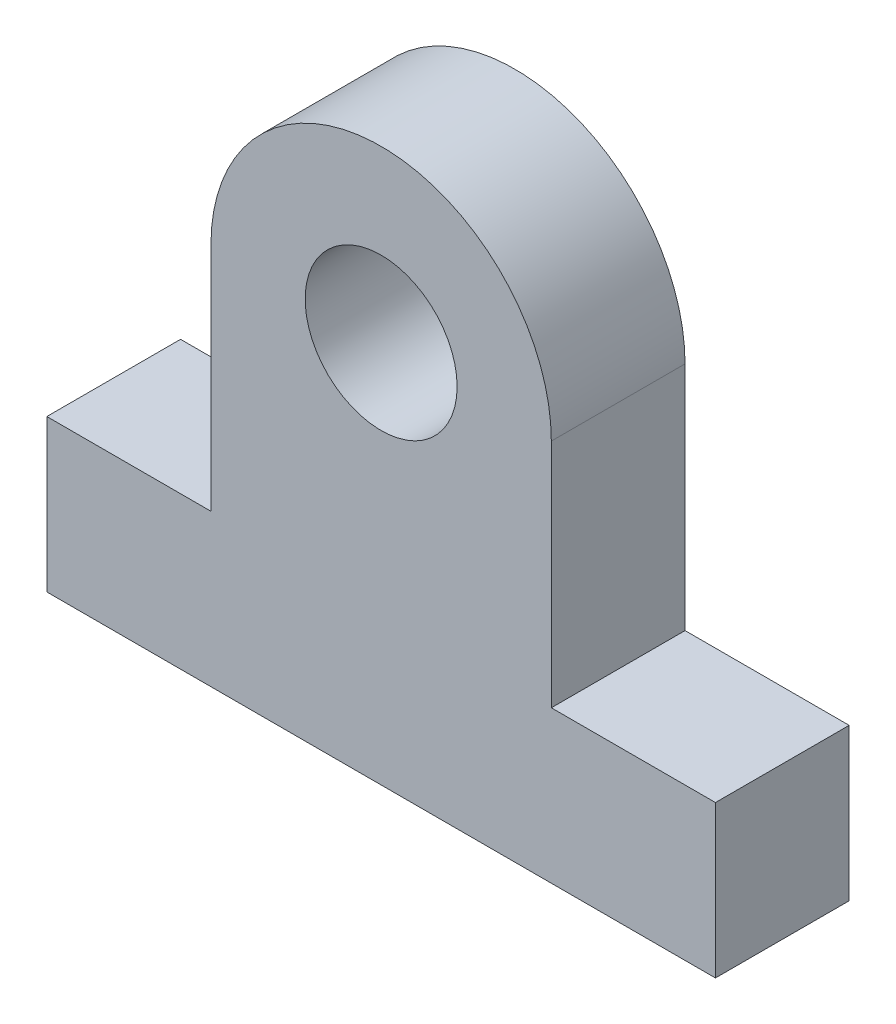
from build123d import *

# Parameters (mm, degrees)
SKETCH1_R           = 12.5
BOSS_EXTRUDE1_DEPTH = 11


with BuildPart() as part:
    # Sketch1 → Boss-Extrude1 (new, symmetric)
    with BuildSketch(Plane.XY):
        with BuildLine():
            Line((-55, 0), (55, 0))
            Line((55, 0), (55, 25))
            Line((55, 25), (28, 25))
            Line((28, 25), (28, 63))
            ThreePointArc((28, 63), (0, 91), (-28, 63))
            Line((-28, 63), (-28, 25))
            Line((-28, 25), (-55, 25))
            Line((-55, 25), (-55, 0))
        make_face()
        with Locations((0, 63)):
            Circle(SKETCH1_R, mode=Mode.SUBTRACT)
    extrude(amount=BOSS_EXTRUDE1_DEPTH, both=True)


solid = part.part
